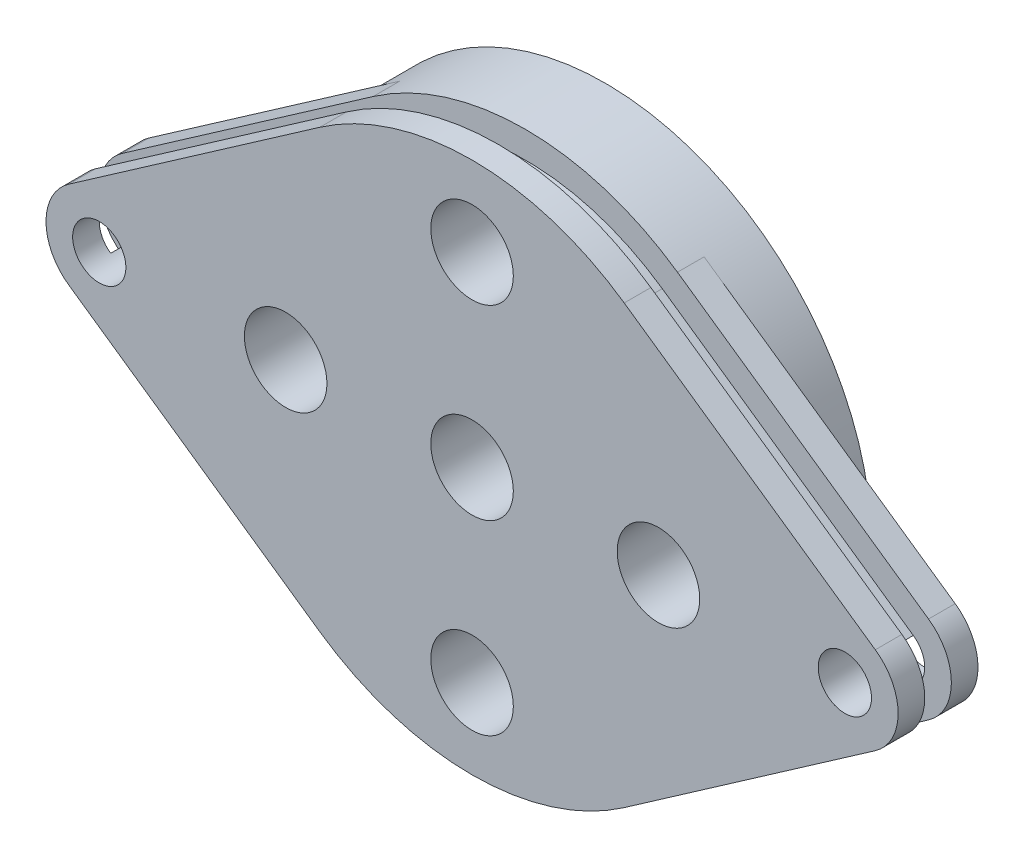
from build123d import *

# Parameters (mm, degrees)
SKETCH_1_R      = 10
SKETCH_1_R_2    = 1.55
EXTRUDE_1_DEPTH = 2
SKETCH_2_R      = 1
SKETCH_2_R_2    = 1.55
EXTRUDE_2_DEPTH = 1
SKETCH_2_3_R    = 1.55
EXTRUDE_3_DEPTH = 2
SKETCH_3_R      = 1.55
SKETCH_3_R_2    = 1
EXTRUDE_5_DEPTH = 1


with BuildPart() as part:
    # 草图1 → 凸台-拉伸1 (new body)
    with BuildSketch(Plane.XY):
        Circle(SKETCH_1_R)
        Circle(SKETCH_1_R_2, mode=Mode.SUBTRACT)
        with Locations((-7, 0)):
            Circle(SKETCH_1_R_2, mode=Mode.SUBTRACT)
        with Locations((0, 7)):
            Circle(SKETCH_1_R_2, mode=Mode.SUBTRACT)
        with Locations((7, 0)):
            Circle(SKETCH_1_R_2, mode=Mode.SUBTRACT)
        with Locations((0, -7)):
            Circle(SKETCH_1_R_2, mode=Mode.SUBTRACT)
    extrude(amount=EXTRUDE_1_DEPTH)

    # 草图2 → 凸台-拉伸2 (add)
    with BuildSketch(Plane.XY.offset(2)):
        with BuildLine():
            Line((-15.142857143, -1.641303613), (-5.714285714, -8.206518066))
            ThreePointArc((-5.714285714, -8.206518066), (0, -10), (5.714285714, -8.206518066))
            Line((5.714285714, -8.206518066), (15.142857143, -1.641303613))
            ThreePointArc((15.142857143, -1.641303613), (16, 0), (15.142857143, 1.641303613))
            Line((15.142857143, 1.641303613), (5.714285714, 8.206518066))
            ThreePointArc((5.714285714, 8.206518066), (0, 10), (-5.714285714, 8.206518066))
            Line((-5.714285714, 8.206518066), (-15.142857143, 1.641303613))
            ThreePointArc((-15.142857143, 1.641303613), (-16, 0), (-15.142857143, -1.641303613))
        make_face()
        with Locations((-14, 0)):
            Circle(SKETCH_2_R, mode=Mode.SUBTRACT)
        with Locations((14, 0)):
            Circle(SKETCH_2_R, mode=Mode.SUBTRACT)
        Circle(SKETCH_2_R_2, mode=Mode.SUBTRACT)
        with Locations((7, 0)):
            Circle(SKETCH_2_R_2, mode=Mode.SUBTRACT)
        with Locations((0, 7)):
            Circle(SKETCH_2_R_2, mode=Mode.SUBTRACT)
        with Locations((0, -7)):
            Circle(SKETCH_2_R_2, mode=Mode.SUBTRACT)
        with Locations((-7, 0)):
            Circle(SKETCH_2_R_2, mode=Mode.SUBTRACT)
    extrude(amount=EXTRUDE_2_DEPTH)

    # 草图2<3> → 凸台-拉伸3 (add)
    with BuildSketch(Plane.XY.offset(2)):
        with BuildLine():
            Line((-14.571428571, -0.820651807), (-5.142857143, -7.38586626))
            ThreePointArc((-5.142857143, -7.38586626), (0, -9), (5.142857143, -7.38586626))
            Line((5.142857143, -7.38586626), (14.571428571, -0.820651807))
            ThreePointArc((14.571428571, -0.820651807), (13, 0), (14.571428571, 0.820651807))
            Line((14.571428571, 0.820651807), (5.142857143, 7.38586626))
            ThreePointArc((5.142857143, 7.38586626), (0, 9), (-5.142857143, 7.38586626))
            Line((-5.142857143, 7.38586626), (-14.571428571, 0.820651807))
            ThreePointArc((-14.571428571, 0.820651807), (-13, 0), (-14.571428571, -0.820651807))
        make_face()
        with Locations((0, 7)):
            Circle(SKETCH_2_3_R, mode=Mode.SUBTRACT)
        with Locations((0, -7)):
            Circle(SKETCH_2_3_R, mode=Mode.SUBTRACT)
        with Locations((-7, 0)):
            Circle(SKETCH_2_3_R, mode=Mode.SUBTRACT)
        Circle(SKETCH_2_3_R, mode=Mode.SUBTRACT)
        with Locations((7, 0)):
            Circle(SKETCH_2_3_R, mode=Mode.SUBTRACT)
    extrude(amount=EXTRUDE_3_DEPTH)

    # 草图3 → 凸台-拉伸5 (add)
    with BuildSketch(Plane.XY.offset(4)):
        with BuildLine():
            Line((15.142857143, 1.641303613), (5.714285714, 8.206518066))
            ThreePointArc((5.714285714, 8.206518066), (0, 10), (-5.714285714, 8.206518066))
            Line((-5.714285714, 8.206518066), (-15.142857143, 1.641303613))
            ThreePointArc((-15.142857143, 1.641303613), (-16, 0), (-15.142857143, -1.641303613))
            Line((-15.142857143, -1.641303613), (-5.714285714, -8.206518066))
            ThreePointArc((-5.714285714, -8.206518066), (0, -10), (5.714285714, -8.206518066))
            Line((5.714285714, -8.206518066), (15.142857143, -1.641303613))
            ThreePointArc((15.142857143, -1.641303613), (16, 0), (15.142857143, 1.641303613))
        make_face()
        with Locations((0, 7)):
            Circle(SKETCH_3_R, mode=Mode.SUBTRACT)
        with Locations((7, 0)):
            Circle(SKETCH_3_R, mode=Mode.SUBTRACT)
        with Locations((0, -7)):
            Circle(SKETCH_3_R, mode=Mode.SUBTRACT)
        Circle(SKETCH_3_R, mode=Mode.SUBTRACT)
        with Locations((-7, 0)):
            Circle(SKETCH_3_R, mode=Mode.SUBTRACT)
        with Locations((-14, 0)):
            Circle(SKETCH_3_R_2, mode=Mode.SUBTRACT)
        with Locations((14, 0)):
            Circle(SKETCH_3_R_2, mode=Mode.SUBTRACT)
    extrude(amount=EXTRUDE_5_DEPTH)


solid = part.part
